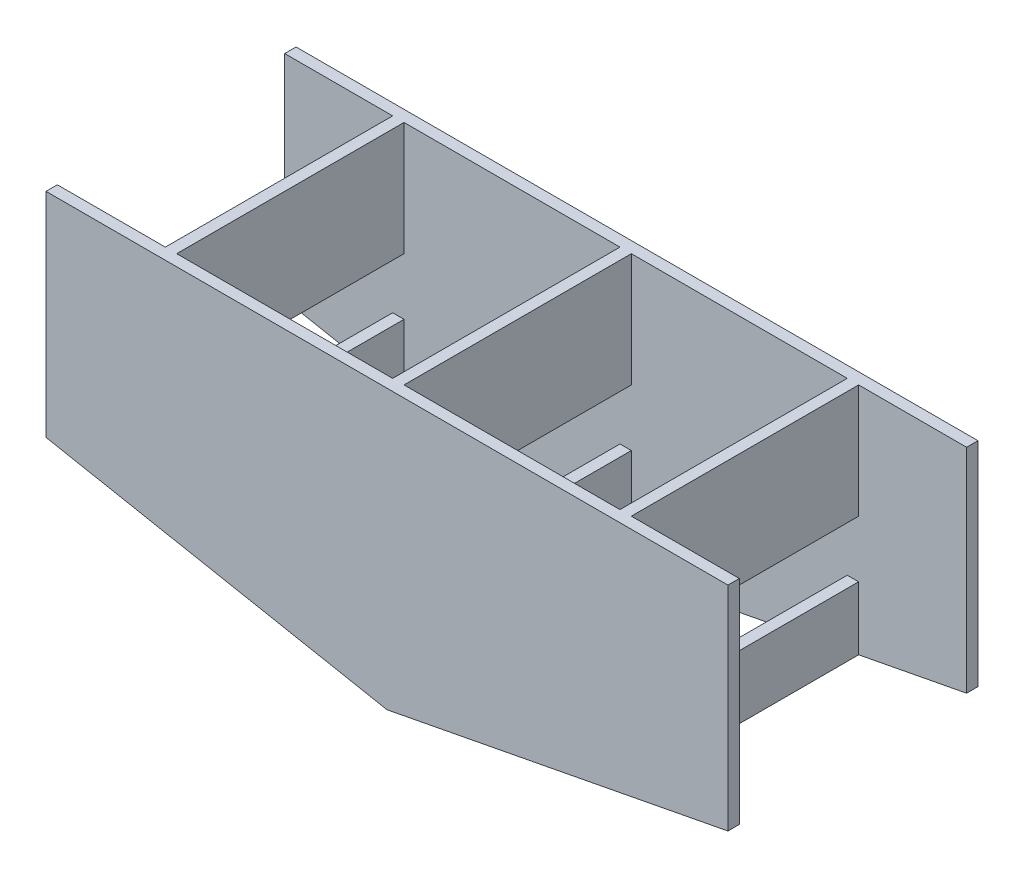
from build123d import *

# Parameters (mm, degrees)
BOSS_EXTRUDE1_DEPTH     = 111.76
SKETCH5_W               = 304.8
SKETCH5_H               = 25.4
CUT_EXTRUDE3_DEPTH      = 101.6
CUT_EXTRUDE4_DEPTH      = 227.288199427
CUT_EXTRUDE4_DEPTH_BACK = 227.288199427
SKETCH3_W               = 96.52
SKETCH3_H               = 101.6
SKETCH3_W_2             = 48.26


with BuildPart() as part:
    # Sketch1 → Boss-Extrude1 (new body)
    with BuildSketch(Plane.XY):
        Polygon((-152.4, 62.23), (-152.4, -33.02), (0, -62.23), (152.4, -32.976439839), (152.4, 62.23), align=None)
    extrude(amount=-BOSS_EXTRUDE1_DEPTH)

    # Sketch5 → Cut-Extrude3 (cut)
    with BuildSketch(Plane.XY.offset(-5.08)):
        with Locations((0, -1.27)):
            Rectangle(SKETCH5_W, SKETCH5_H)
    extrude(amount=-CUT_EXTRUDE3_DEPTH, mode=Mode.SUBTRACT)

    # Sketch3 → Cut-Extrude4 (cut, two sides: drawn at the far end of the back side and taken through both)
    with BuildSketch(Plane(origin=(0, 62.23, 0), x_dir=(1, 0, 0), z_dir=(0, 1, 0)).offset(-CUT_EXTRUDE4_DEPTH_BACK)):
        with Locations((-50.8, 55.88)):
            Rectangle(SKETCH3_W, SKETCH3_H)
        with Locations((50.8, 55.88)):
            Rectangle(SKETCH3_W, SKETCH3_H)
        with Locations((-128.27, 55.88)):
            Rectangle(SKETCH3_W_2, SKETCH3_H)
        with Locations((128.27, 55.88)):
            Rectangle(SKETCH3_W_2, SKETCH3_H)
    extrude(amount=CUT_EXTRUDE4_DEPTH + CUT_EXTRUDE4_DEPTH_BACK, mode=Mode.SUBTRACT)


solid = part.part
